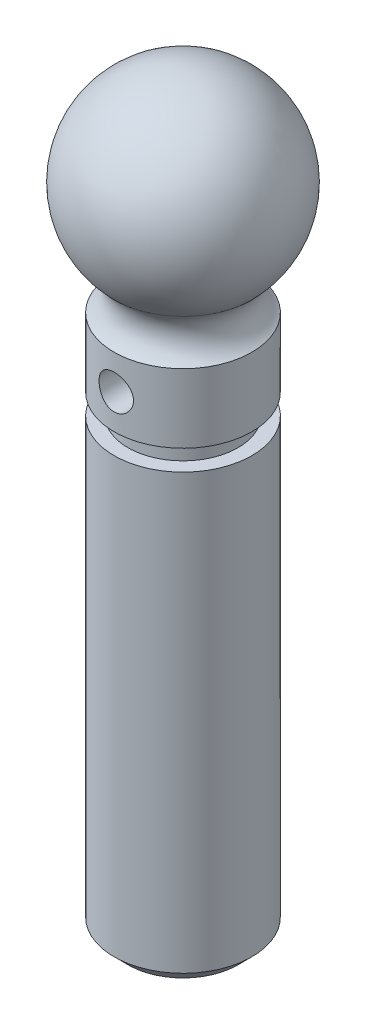
from build123d import *

# Parameters (mm, degrees)
ESQUISSE1_ONE_SIDE_W         = 80
ESQUISSE1_ONE_SIDE_H         = 30
ESQUISSE1_ONE_SIDE_W_2       = 100
ESQUISSE1_ONE_SIDE_H_2       = 630
ENL_V_MAT_EXTRU_2_DEPTH      = 952.933780363
ENL_V_MAT_EXTRU_2_DEPTH_BACK = 952.933780363
ESQUISSE2_R                  = 25


with BuildPart() as part:
    # Esquisse1 one side → Révolution1 (revolve)
    with BuildSketch(Plane.XY, mode=Mode.PRIVATE) as r_volution1_sk:
        with BuildLine():
            Line((0, 552.370333546), (0, 602.370333546))
            ThreePointArc((0, 602.370333546), (-25, 577.370333546), (0, 552.370333546))
        make_face()
        with BuildLine():
            Line((0, 693.136902569), (100, 693.136902569))
            ThreePointArc((100, 693.136902569), (129.068087767, 845.351432312), (0, 931.11649228))
            Line((0, 931.11649228), (0, 693.136902569))
        make_face()
        with BuildLine():
            ThreePointArc((100, 693.136902569), (82.774757951, 660.253618058), (100, 627.370333546))
            Line((100, 627.370333546), (0, 627.370333546))
            Line((0, 627.370333546), (0, 693.136902569))
            Line((0, 693.136902569), (100, 693.136902569))
        make_face()
        Polygon((0, 527.370333546), (0, 627.370333546), (100, 627.370333546), (100, 527.370333546), (80, 527.370333546), align=None)
        with Locations((40, 512.370333546)):
            Rectangle(ESQUISSE1_ONE_SIDE_W, ESQUISSE1_ONE_SIDE_H)
        with BuildLine():
            ThreePointArc((0, 602.370333546), (-25, 577.370333546), (0, 552.370333546))
            Line((0, 552.370333546), (0, 602.370333546))
        make_face()
        with BuildLine():
            Line((0, 602.370333546), (0, 552.370333546))
            ThreePointArc((0, 552.370333546), (17.67766953, 559.692664016), (25, 577.370333546))
            ThreePointArc((25, 577.370333546), (17.67766953, 595.048003076), (0, 602.370333546))
        make_face()
        with Locations((50, 182.370333546)):
            Rectangle(ESQUISSE1_ONE_SIDE_W_2, ESQUISSE1_ONE_SIDE_H_2)
        Polygon((100, -132.629666454), (0, -132.629666454), (0, -152.629666454), (80, -152.629666454), align=None)
    revolve(r_volution1_sk.sketch.rotate(Axis((0, -208.828974679, 0), (0, 1, 0)), 90), axis=Axis((0, -208.828974679, 0), (0, 1, 0)))

    # Esquisse2 → Enlèv. mat.-Extru.2 (cut, two sides: drawn at the far end of the back side and taken through both)
    with BuildSketch(Plane.XY.offset(-ENL_V_MAT_EXTRU_2_DEPTH_BACK)):
        with Locations((0, 577.370333546)):
            Circle(ESQUISSE2_R)
    extrude(amount=ENL_V_MAT_EXTRU_2_DEPTH + ENL_V_MAT_EXTRU_2_DEPTH_BACK, mode=Mode.SUBTRACT)


solid = part.part
